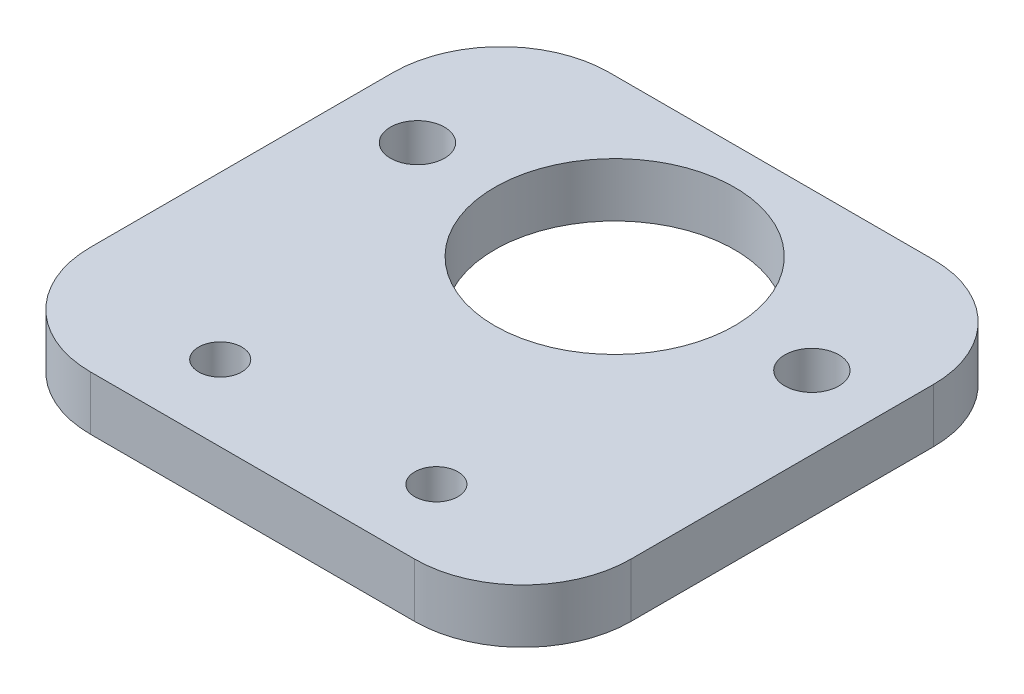
from build123d import *

# Parameters (mm, degrees)
ESBO_O1_W                = 50
ESBO_O1_H                = 48
RESSALTO_EXTRUS_O1_DEPTH = 5
ESBO_O2_R                = 11.1
ESBO_O2_R_2              = 2.5
CORTE_EXTRUS_O1_DEPTH    = 5
FILETE1_R                = 10
FILETE2_R                = 10
FILETE3_R                = 10
FILETE4_R                = 10
ESBO_O3_R                = 2
CORTE_EXTRUS_O2_DEPTH    = 22


with BuildPart() as part:
    # Esboço1 → Ressalto-extrusão1 (new body)
    with BuildSketch(Plane(origin=(0, 0, 0), x_dir=(1, 0, 0), z_dir=(0, 1, 0))):
        with Locations((25, 24)):
            Rectangle(ESBO_O1_W, ESBO_O1_H)
    extrude(amount=RESSALTO_EXTRUS_O1_DEPTH)

    # Esboço2 → Corte-extrusão1 (cut)
    with BuildSketch(Plane(origin=(0, 5, 0), x_dir=(1, 0, 0), z_dir=(0, 1, 0))):
        with Locations(Location((25, 33.5, 0), (0, 0, 270))):
            Circle(ESBO_O2_R)
        with Locations(Location((6.75, 33.5, 0), (0, 0, 270))):
            Circle(ESBO_O2_R_2)
        with Locations(Location((43.25, 33.5, 0), (0, 0, 90))):
            Circle(ESBO_O2_R_2)
    extrude(amount=-CORTE_EXTRUS_O1_DEPTH, mode=Mode.SUBTRACT)

    # Filete1
    filete1_edges = [part.edges().sort_by_distance(p)[0] for p in [
        (50, 2.5, 0),
    ]]
    fillet(filete1_edges, radius=FILETE1_R)

    # Filete2
    filete2_edges = [part.edges().sort_by_distance(p)[0] for p in [
        (0, 2.5, 0),
    ]]
    fillet(filete2_edges, radius=FILETE2_R)

    # Filete3
    filete3_edges = [part.edges().sort_by_distance(p)[0] for p in [
        (50, 2.5, -48),
    ]]
    fillet(filete3_edges, radius=FILETE3_R)

    # Filete4
    filete4_edges = [part.edges().sort_by_distance(p)[0] for p in [
        (0, 2.5, -48),
    ]]
    fillet(filete4_edges, radius=FILETE4_R)

    # Esboço3 → Corte-extrusão2 (cut)
    with BuildSketch(Plane(origin=(0, 5, 0), x_dir=(1, 0, 0), z_dir=(0, 1, 0))):
        with Locations(Location((15, 7, 0), (0, 0, 270))):
            Circle(ESBO_O3_R)
        with Locations(Location((35, 7, 0), (0, 0, 90))):
            Circle(ESBO_O3_R)
    extrude(amount=-CORTE_EXTRUS_O2_DEPTH, mode=Mode.SUBTRACT)


solid = part.part
